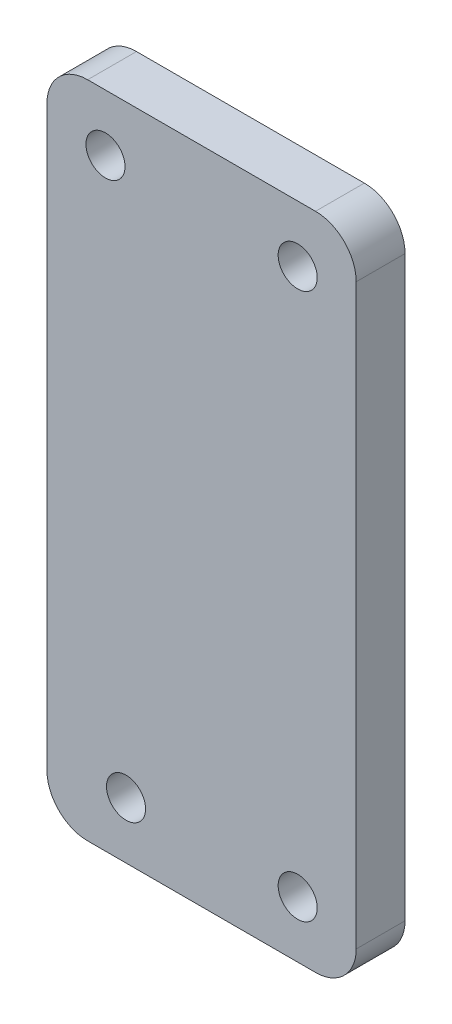
from build123d import *

# Parameters (mm, degrees)
SKETCH1_W            = 38
SKETCH1_H            = 81
BOSS_EXTRUDE1_DEPTH  = 6
M4_CLEARANCE_HOLE1_D = 4.8
FILLET1_R            = 5


with BuildPart() as part:
    # Sketch1 → Boss-Extrude1 (new body)
    with BuildSketch(Plane.XY):
        Rectangle(SKETCH1_W, SKETCH1_H)
    extrude(amount=BOSS_EXTRUDE1_DEPTH)

    # M4 Clearance Hole1 (through all)
    with Locations(Plane.XY.offset(6)):
        with Locations((-11.80805, 33.54195), (11.80805, 33.54195), (11.80805, -33.54195), (-9.28425, -33.54195)):
            Hole(M4_CLEARANCE_HOLE1_D / 2)

    # Fillet1
    fillet1_edges = [part.edges().sort_by_distance(p)[0] for p in [
        (19, -40.5, 3),
        (-19, -40.5, 3),
        (-19, 40.5, 3),
        (19, 40.5, 3),
    ]]
    fillet(fillet1_edges, radius=FILLET1_R)


solid = part.part
